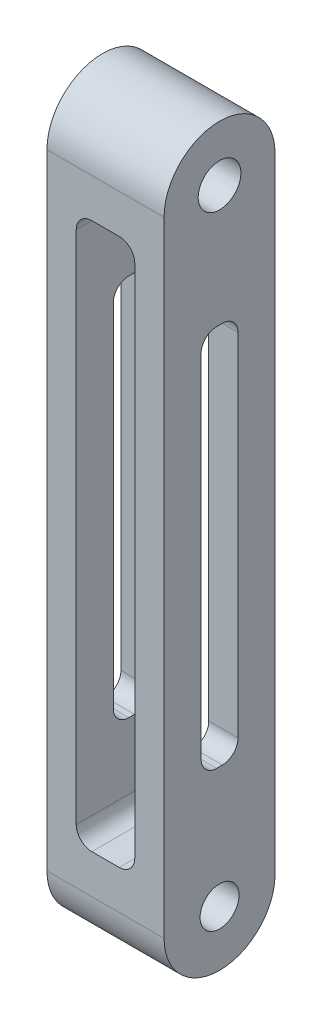
from build123d import *

# Parameters (mm, degrees)
SKETCH2_R           = 2.5
SKETCH2_R_2         = 2.734092972
BOSS_EXTRUDE1_DEPTH = 15
CUT_EXTRUDE1_DEPTH  = 30


with BuildPart() as part:
    # Sketch2 → Boss-Extrude1 (new body)
    with BuildSketch(Plane(origin=(0, 0, 0), x_dir=(0, 0, -1), z_dir=(1, 0, 0))):
        with BuildLine():
            Line((7.108641727, -80), (7.108641727, 0))
            ThreePointArc((7.108641727, 0), (0, 7.108641727), (-7.108641727, 0))
            Line((-7.108641727, 0), (-7.108641727, -80))
            ThreePointArc((-7.108641727, -80), (0, -87.108641727), (7.108641727, -80))
        make_face()
        with Locations((0, -80)):
            Circle(SKETCH2_R, mode=Mode.SUBTRACT)
        with BuildLine():
            Line((-0.366207439, -15.5), (0, -15.5))
            Line((0, -15.5), (0.366207439, -15.5))
            ThreePointArc((0.366207439, -15.5), (1.780421002, -16.085786438), (2.366207439, -17.5))
            Line((2.366207439, -17.5), (2.366207439, -62.5))
            ThreePointArc((2.366207439, -62.5), (1.780421002, -63.914213562), (0.366207439, -64.5))
            Line((0.366207439, -64.5), (-0.366207439, -64.5))
            ThreePointArc((-0.366207439, -64.5), (-1.780421002, -63.914213562), (-2.366207439, -62.5))
            Line((-2.366207439, -62.5), (-2.366207439, -17.5))
            ThreePointArc((-2.366207439, -17.5), (-1.780421002, -16.085786438), (-0.366207439, -15.5))
        make_face(mode=Mode.SUBTRACT)
        Circle(SKETCH2_R_2, mode=Mode.SUBTRACT)
    extrude(amount=BOSS_EXTRUDE1_DEPTH)

    # Sketch3 → Cut-Extrude1 (cut)
    with BuildSketch(Plane(origin=(0, 0, -7.108641727), x_dir=(-1, 0, 0), z_dir=(0, 0, -1))):
        with BuildLine():
            Line((-5.75, -5), (-7.5, -5))
            Line((-7.5, -5), (-7.5, -75))
            Line((-7.5, -75), (-5.75, -75))
            ThreePointArc((-5.75, -75), (-4.335786438, -74.414213562), (-3.75, -73))
            Line((-3.75, -73), (-3.75, -7))
            ThreePointArc((-3.75, -7), (-4.335786438, -5.585786438), (-5.75, -5))
        make_face()
        with BuildLine():
            Line((-7.5, -75), (-7.5, -5))
            Line((-7.5, -5), (-9.25, -5))
            ThreePointArc((-9.25, -5), (-10.664213562, -5.585786438), (-11.25, -7))
            Line((-11.25, -7), (-11.25, -73))
            ThreePointArc((-11.25, -73), (-10.664213562, -74.414213562), (-9.25, -75))
            Line((-9.25, -75), (-7.5, -75))
        make_face()
    extrude(amount=-CUT_EXTRUDE1_DEPTH, mode=Mode.SUBTRACT)


solid = part.part
